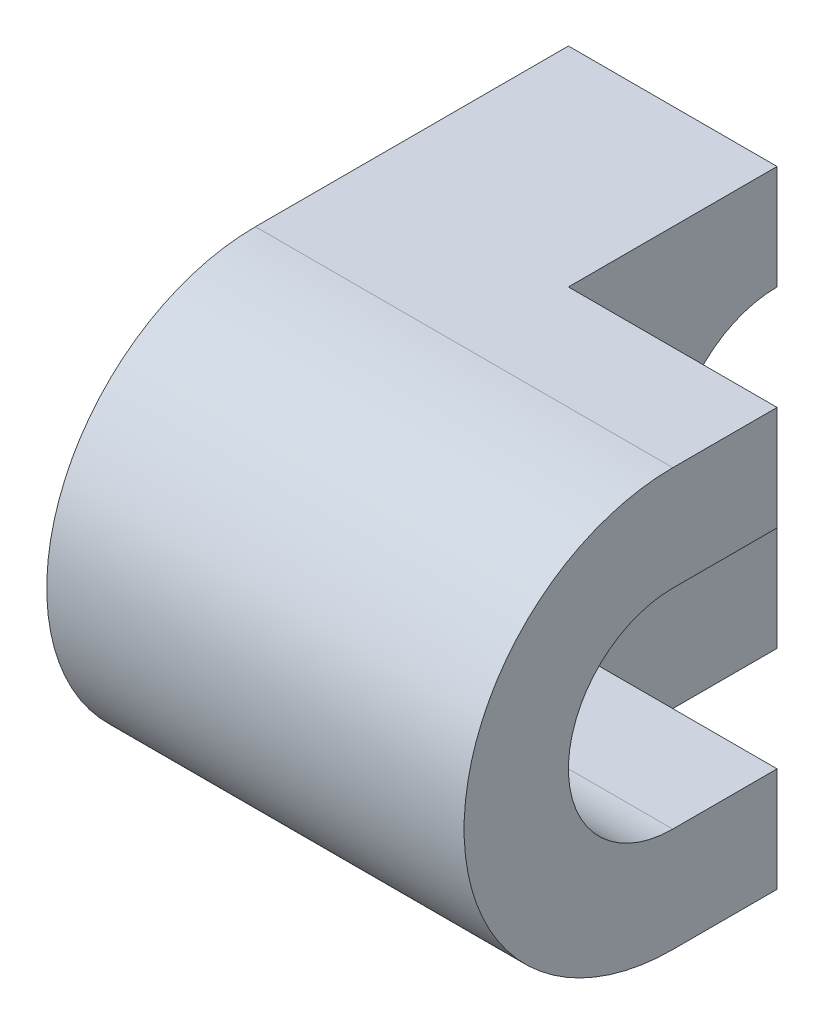
from build123d import *

# Parameters (mm, degrees)
BOSS_EXTRUDE1_DEPTH = 20
BOSS_EXTRUDE2_DEPTH = 20


with BuildPart() as part:
    # Sketch1 → Boss-Extrude1 (new body)
    with BuildSketch(Plane(origin=(0, 0, 0), x_dir=(0, 0, -1), z_dir=(1, 0, 0))):
        with BuildLine():
            Line((0, 20), (30, 20))
            Line((30, 20), (30, 10))
            ThreePointArc((30, 10), (20, 0), (30, -10))
            Line((30, -10), (30, -20))
            Line((30, -20), (0, -20))
            ThreePointArc((0, -20), (-20, 0), (0, 20))
        make_face()
    extrude(amount=BOSS_EXTRUDE1_DEPTH)

    # Sketch2 → Boss-Extrude2 (add)
    with BuildSketch(Plane(origin=(20, 0, 0), x_dir=(0, 0, -1), z_dir=(1, 0, 0))):
        with BuildLine():
            Line((0, 20), (10, 20))
            Line((10, 20), (10, 10))
            Line((10, 10), (0, 10))
            ThreePointArc((0, 10), (-10, 0), (0, -10))
            Line((0, -10), (10, -10))
            Line((10, -10), (10, -20))
            Line((10, -20), (0, -20))
            ThreePointArc((0, -20), (-20, 0), (0, 20))
        make_face()
    extrude(amount=BOSS_EXTRUDE2_DEPTH)


solid = part.part
